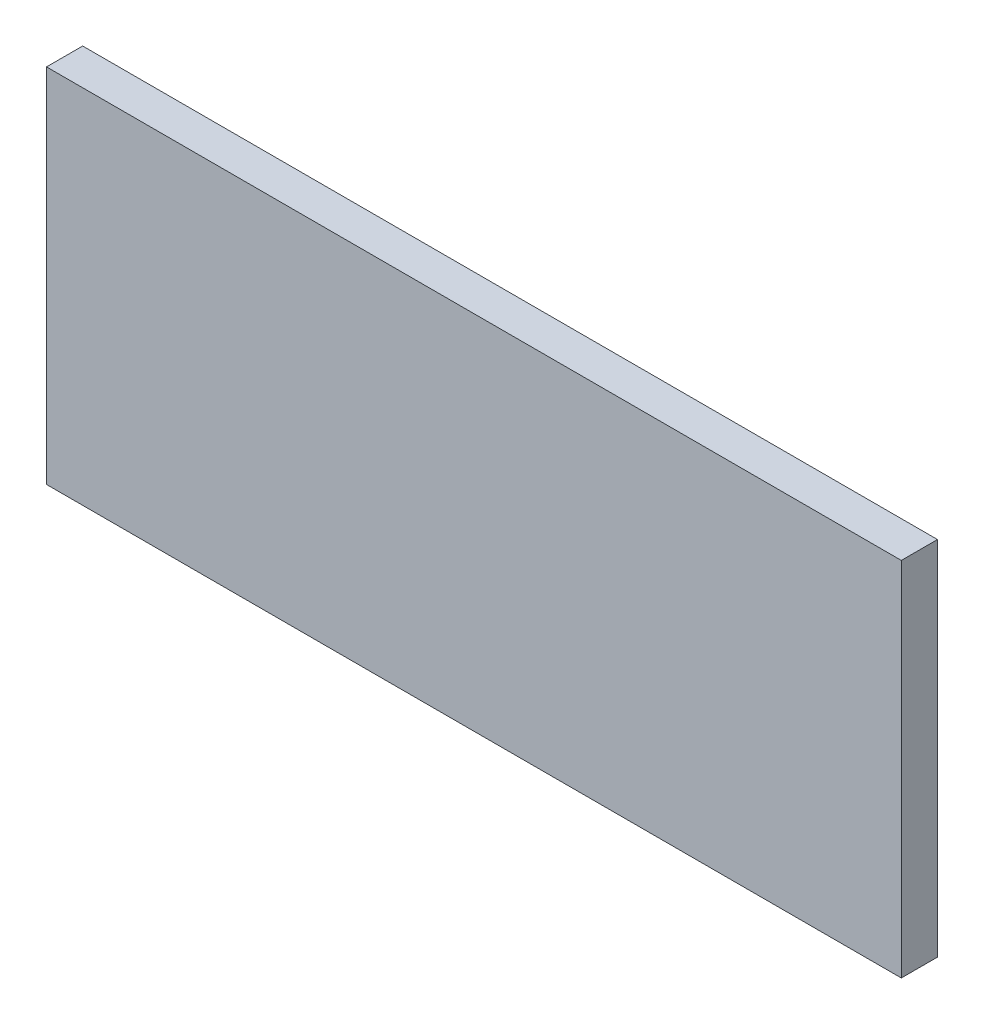
from build123d import *

# Parameters (mm, degrees)
CROQUIS1_W              = 52
CROQUIS1_H              = 22
SALIENTE_EXTRUIR1_DEPTH = 1.1


with BuildPart() as part:
    # Croquis1 → Saliente-Extruir1 (new, symmetric)
    with BuildSketch(Plane.XY):
        Rectangle(CROQUIS1_W, CROQUIS1_H)
    extrude(amount=SALIENTE_EXTRUIR1_DEPTH, both=True)


solid = part.part
